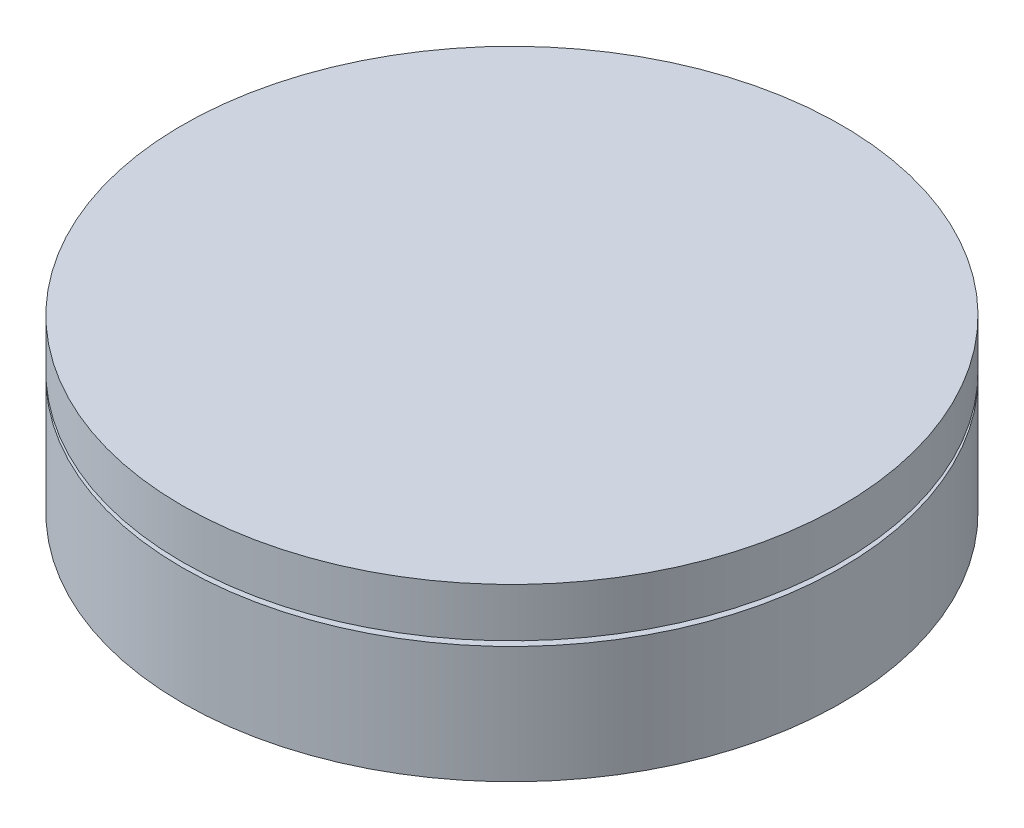
from build123d import *

# Parameters (mm, degrees)
SKETCH1_R           = 67.5
BOSS_EXTRUDE1_DEPTH = 35
CUT_EXTRUDE1_START  = -11
SKETCH2_R           = 67.5
SKETCH2_R_2         = 47.5
CUT_EXTRUDE1_DEPTH  = 1


with BuildPart() as part:
    # Sketch1 → Boss-Extrude1 (new body)
    with BuildSketch(Plane(origin=(0, 0, 0), x_dir=(1, 0, 0), z_dir=(0, 1, 0))):
        with Locations(Location((0, 0, 0), (0, 0, 270))):
            Circle(SKETCH1_R)
    extrude(amount=BOSS_EXTRUDE1_DEPTH)

    # Sketch2 → Cut-Extrude1 (cut)
    with BuildSketch(Plane(origin=(0, 35, 0), x_dir=(1, 0, 0), z_dir=(0, 1, 0)).offset(CUT_EXTRUDE1_START)):
        with Locations(Location((0, 0, 0), (0, 0, 270))):
            Circle(SKETCH2_R)
        with Locations(Location((0, 0, 0), (0, 0, 270))):
            Circle(SKETCH2_R_2, mode=Mode.SUBTRACT)
    extrude(amount=CUT_EXTRUDE1_DEPTH, mode=Mode.SUBTRACT)


solid = part.part
